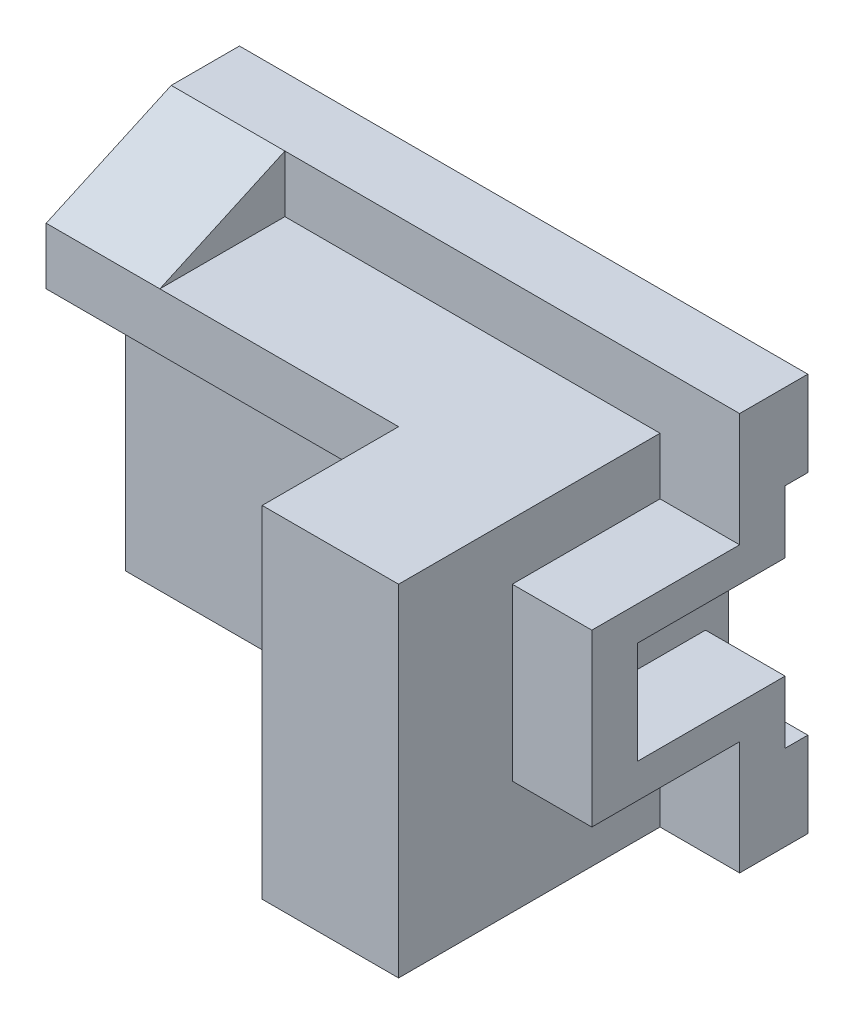
from build123d import *

# Parameters (mm, degrees)
SKETCH_1_W          = 50
SKETCH_1_H          = 35
EXTRUDE_1_DEPTH     = 6
SKETCH_2_W          = 12
SKETCH_2_H          = 30
EXTRUDE_2_DEPTH     = 23
SKETCH_7_W          = 13
SKETCH_7_H          = 15
EXTRUDE_3_DEPTH     = 7
SKETCH_8_W          = 13
SKETCH_8_H          = 9
SKETCH_8_W_2        = 2
SKETCH_8_H_2        = 5.5
CUT_EXTRUDE_4_DEPTH = 7
EXTRUDE_4_DEPTH     = 31
SKETCH_11_W         = 11
SKETCH_11_H         = 5
CUT_EXTRUDE_5_DEPTH = 21
SKETCH_12_W         = 31
SKETCH_12_H         = 25
EXTRUDE_5_DEPTH     = 4


with BuildPart() as part:
    # Эскиз1 → Бобышка-Вытянуть1 (new body)
    with BuildSketch(Plane.XY):
        Rectangle(SKETCH_1_W, SKETCH_1_H)
    extrude(amount=EXTRUDE_1_DEPTH)

    # Эскиз2 → Бобышка-Вытянуть2 (add)
    with BuildSketch(Plane.XY.offset(6)):
        with Locations((12, -2.5)):
            Rectangle(SKETCH_2_W, SKETCH_2_H)
    extrude(amount=EXTRUDE_2_DEPTH)

    # Эскиз7 → Бобышка-Вытянуть3 (add)
    with BuildSketch(Plane(origin=(18, 0, 0), x_dir=(0, 0, -1), z_dir=(1, 0, 0))):
        with Locations((-12.5, 0)):
            Rectangle(SKETCH_7_W, SKETCH_7_H)
    extrude(amount=EXTRUDE_3_DEPTH)

    # Эскиз8 → Вырез-Вытянуть4 (cut)
    with BuildSketch(Plane(origin=(25, 0, 0), x_dir=(0, 0, -1), z_dir=(1, 0, 0))):
        with Locations((-8.5, 0)):
            Rectangle(SKETCH_8_W, SKETCH_8_H)
        with Locations((-1, -7.25)):
            Rectangle(SKETCH_8_W_2, SKETCH_8_H_2)
        with Locations((-1, 0)):
            Rectangle(SKETCH_8_W_2, SKETCH_8_H)
        with Locations((-1, 7.25)):
            Rectangle(SKETCH_8_W_2, SKETCH_8_H_2)
    extrude(amount=-CUT_EXTRUDE_4_DEPTH, mode=Mode.SUBTRACT)

    # Эскиз9 → Бобышка-Вытянуть4 (add)
    with BuildSketch(Plane.ZY.offset(25)):
        Polygon((6, 17.5), (17, 12.5), (17, 7.5), (6, 7.5), align=None)
    extrude(amount=-EXTRUDE_4_DEPTH)

    # Эскиз11 → Вырез-Вытянуть5 (cut)
    with BuildSketch(Plane(origin=(6, 0, 0), x_dir=(0, 0, -1), z_dir=(1, 0, 0))):
        with Locations((-11.5, 15)):
            Rectangle(SKETCH_11_W, SKETCH_11_H)
    extrude(amount=-CUT_EXTRUDE_5_DEPTH, mode=Mode.SUBTRACT)

    # Эскиз12 → Бобышка-Вытянуть5 (add)
    with BuildSketch(Plane.XY.offset(6)):
        with Locations((-9.5, -5)):
            Rectangle(SKETCH_12_W, SKETCH_12_H)
    extrude(amount=EXTRUDE_5_DEPTH)


solid = part.part
